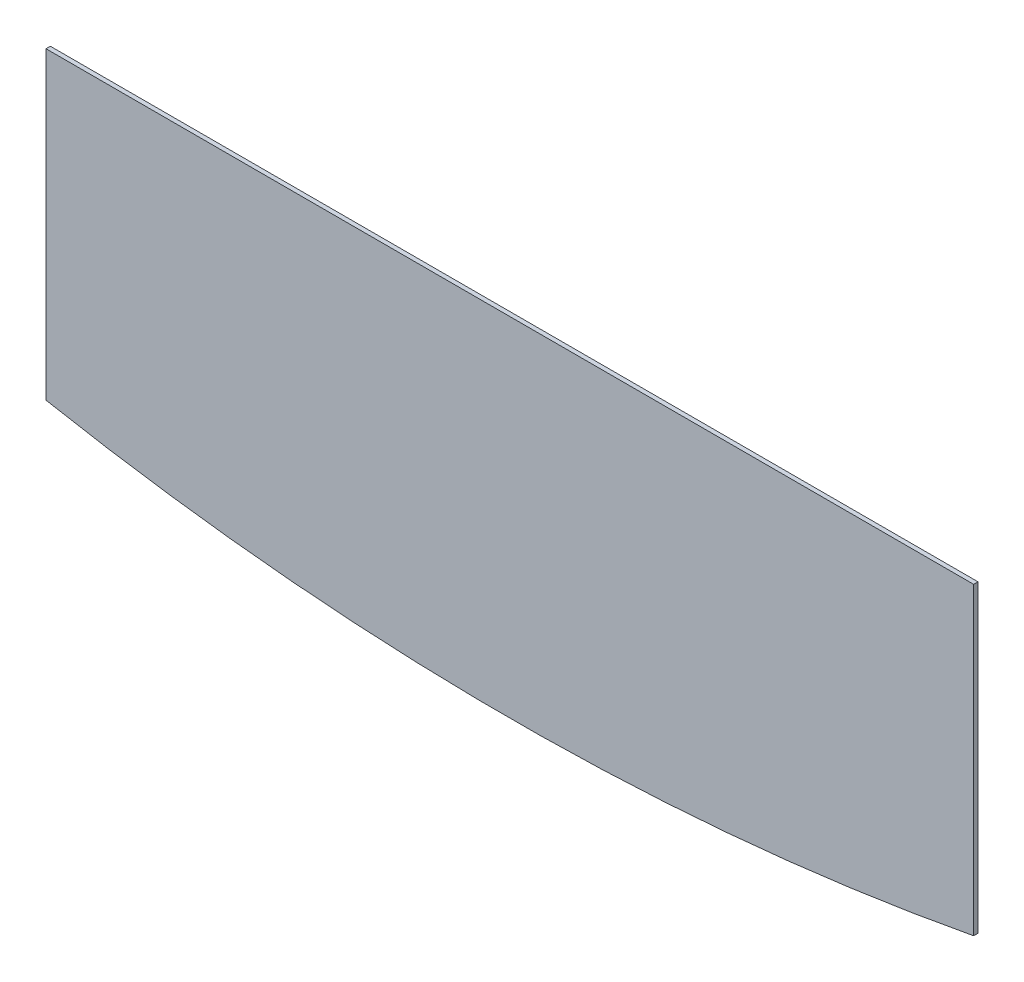
from build123d import *

# Parameters (mm, degrees)
ESQUISSE1_W                  = 320
ESQUISSE1_H                  = 120
BOSS_EXTRU_1_DEPTH           = 1.5
ENL_V_MAT_EXTRU_1_DEPTH      = 342.763441579
ENL_V_MAT_EXTRU_1_DEPTH_BACK = 1.5


with BuildPart() as part:
    # Esquisse1 → Boss.-Extru.1 (new body)
    with BuildSketch(Plane.XY):
        with Locations((160, 60)):
            Rectangle(ESQUISSE1_W, ESQUISSE1_H)
    extrude(amount=BOSS_EXTRU_1_DEPTH)

    # Esquisse2 → Enlèv. mat.-Extru.1 (cut, two sides: drawn at the far end of the back side and taken through both)
    with BuildSketch(Plane.XY.offset(1.5).offset(-ENL_V_MAT_EXTRU_1_DEPTH_BACK)):
        with BuildLine():
            Line((-671.661329364, 142.053177574), (0, 15))
            ThreePointArc((0, 15), (160, 0), (320, 15))
            Line((320, 15), (991.661329364, 142.053177574))
            Line((991.661329364, 142.053177574), (991.661329364, -1225.09195195))
            Line((991.661329364, -1225.09195195), (-671.661329364, -1225.09195195))
            Line((-671.661329364, -1225.09195195), (-671.661329364, 142.053177574))
        make_face()
    extrude(amount=ENL_V_MAT_EXTRU_1_DEPTH + ENL_V_MAT_EXTRU_1_DEPTH_BACK, mode=Mode.SUBTRACT)


solid = part.part
